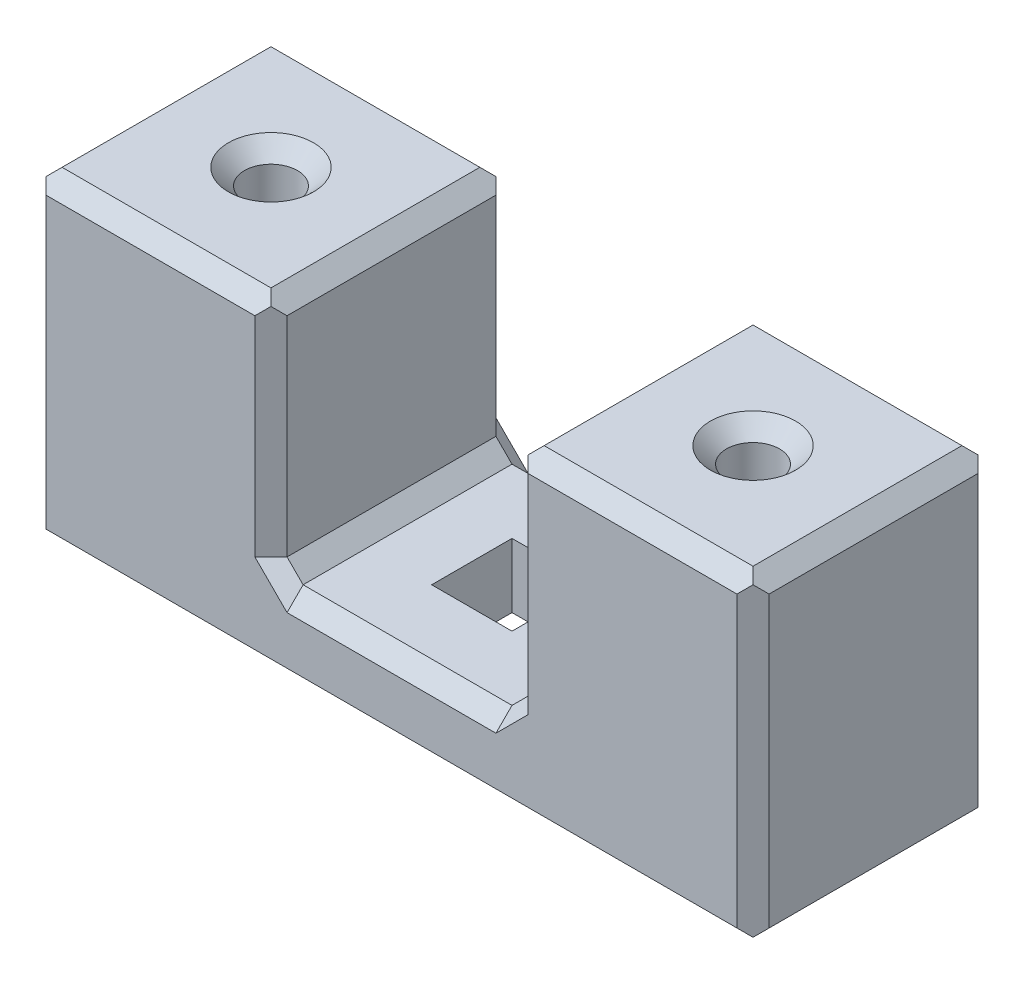
from build123d import *

# Parameters (mm, degrees)
SKETCH1_W           = 45
SKETCH1_H           = 15
SKETCH1_W_2         = 5
SKETCH1_H_2         = 5
BOSS_EXTRUDE1_DEPTH = 20
SKETCH2_W           = 15
SKETCH2_H           = 15
CUT_EXTRUDE1_DEPTH  = 20
SKETCH3_R           = 1.65
CUT_EXTRUDE2_DEPTH  = 10
CHAMFER2_SIZE       = 1
CHAMFER3_SIZE       = 1


with BuildPart() as part:
    # Sketch1 → Boss-Extrude1 (new body)
    with BuildSketch(Plane(origin=(0, 0, 0), x_dir=(1, 0, 0), z_dir=(0, 1, 0))):
        with Locations((22.5, 7.5)):
            Rectangle(SKETCH1_W, SKETCH1_H)
        with Locations((22.5, 7.5)):
            Rectangle(SKETCH1_W_2, SKETCH1_H_2, mode=Mode.SUBTRACT)
    extrude(amount=BOSS_EXTRUDE1_DEPTH)

    # Sketch2 → Cut-Extrude1 (cut)
    with BuildSketch(Plane.XY):
        with Locations((22.5, 12.5)):
            Rectangle(SKETCH2_W, SKETCH2_H)
    extrude(amount=-CUT_EXTRUDE1_DEPTH, mode=Mode.SUBTRACT)

    # Sketch3 → Cut-Extrude2 (cut)
    with BuildSketch(Plane(origin=(0, 20, 0), x_dir=(1, 0, 0), z_dir=(0, 1, 0))):
        with Locations(Location((37.5, 7.5, 0), (0, 0, 270))):
            Circle(SKETCH3_R)
        with Locations(Location((7.5, 7.5, 0), (0, 0, 270))):
            Circle(SKETCH3_R)
    extrude(amount=-CUT_EXTRUDE2_DEPTH, mode=Mode.SUBTRACT)

    # Chamfer2
    chamfer2_edges = [part.edges().sort_by_distance(p)[0] for p in [
        (45, 20, -7.5),
        (20, 0, -7.5),
        (22.5, 0, -5),
        (25, 0, -7.5),
        (22.5, 0, -10),
        (37.5, 20, -15),
        (7.5, 20, -15),
        (37.5, 20, 0),
        (30, 20, -7.5),
        (15, 20, -7.5),
        (0, 20, -7.5),
        (22.5, 0, -15),
        (45, 0, -7.5),
        (37.5, 20, -9.15),
        (22.5, 0, 0),
        (7.5, 20, -9.15),
        (0, 0, -7.5),
        (7.5, 20, 0),
    ]]
    chamfer(chamfer2_edges, length=CHAMFER2_SIZE)

    # Chamfer3
    chamfer3_edges = [part.edges().sort_by_distance(p)[0] for p in [
        (30, 12, -15),
        (15, 5, -7.5),
        (22.5, 5, -15),
        (30, 5, -7.5),
        (22.5, 5, 0),
        (30, 12, 0),
        (45, 10, -15),
        (45, 10, 0),
        (15, 12, 0),
        (0, 10, 0),
        (15, 12, -15),
        (0, 10, -15),
    ]]
    chamfer(chamfer3_edges, length=CHAMFER3_SIZE)


solid = part.part
